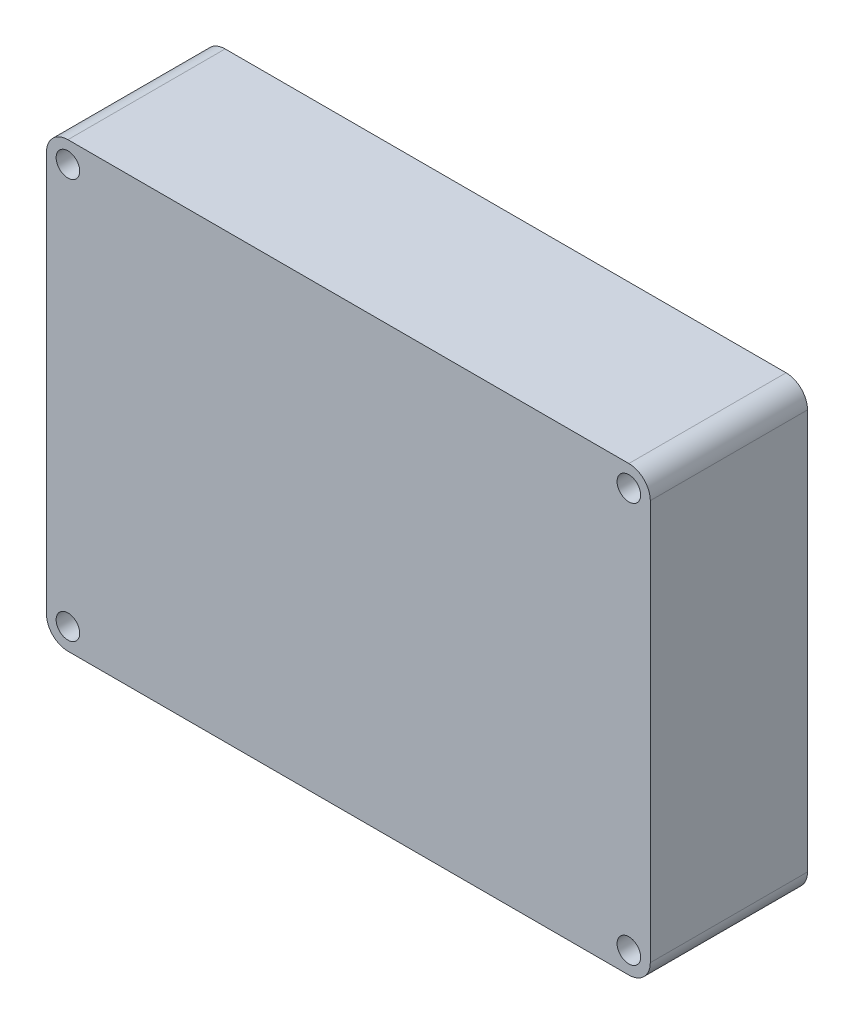
from build123d import *

# Parameters (mm, degrees)
CROQUIS1_W              = 84.5
CROQUIS1_H              = 62
CROQUIS1_R              = 1.65
SALIENTE_EXTRUIR1_DEPTH = 22
REDONDEO1_R             = 3


with BuildPart() as part:
    # Croquis1 → Saliente-Extruir1 (new body)
    with BuildSketch(Plane.XY):
        with Locations((42.25, 31)):
            Rectangle(CROQUIS1_W, CROQUIS1_H)
        with Locations((3, 3)):
            Circle(CROQUIS1_R, mode=Mode.SUBTRACT)
        with Locations((81.5, 3)):
            Circle(CROQUIS1_R, mode=Mode.SUBTRACT)
        with Locations((81.5, 59)):
            Circle(CROQUIS1_R, mode=Mode.SUBTRACT)
        with Locations((3, 59)):
            Circle(CROQUIS1_R, mode=Mode.SUBTRACT)
    extrude(amount=SALIENTE_EXTRUIR1_DEPTH)

    # Redondeo1
    redondeo1_edges = [part.edges().sort_by_distance(p)[0] for p in [
        (0, 62, 11),
        (84.5, 62, 11),
        (84.5, 0, 11),
        (0, 0, 11),
    ]]
    fillet(redondeo1_edges, radius=REDONDEO1_R)


solid = part.part
